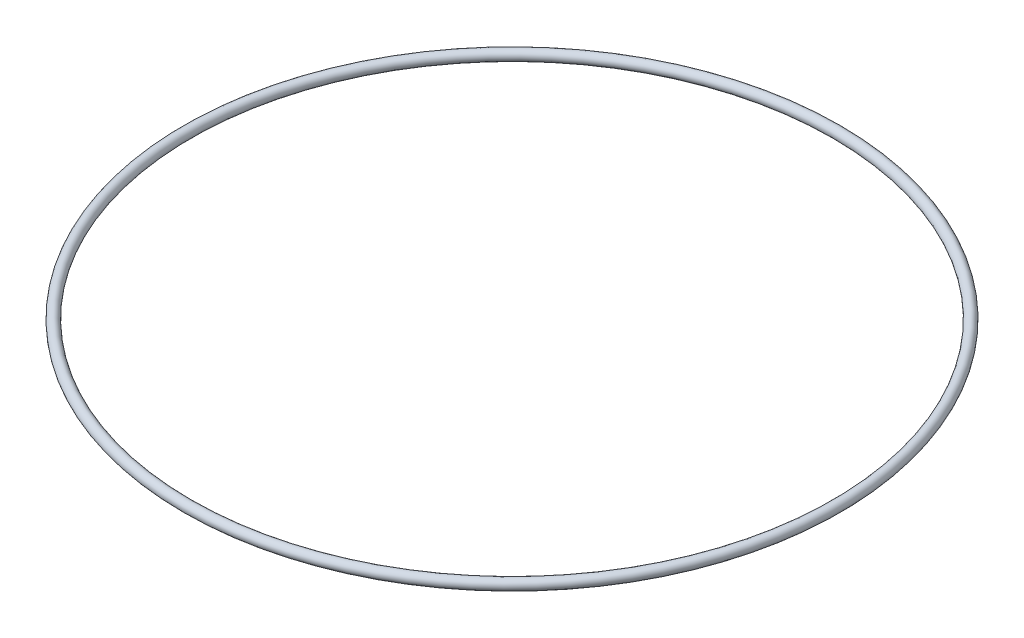
from build123d import *

# Parameters (mm, degrees)
WYCI_GNI_CIE_PO_CIE_CE1_PROFILE_R = 1


with BuildPart() as part:
    # Wyciągnięcie po ścieżce1: sweep along a path in Szkic1
    with BuildLine(Plane(origin=(0, 0, 0), x_dir=(1, 0, 0), z_dir=(0, 1, 0))) as wyci_gni_cie_po_cie_ce1_path:
        CenterArc((0, 0), 62.5, 0, 360)
    # Wyciągnięcie po ścieżce1 profile (on start of the path) → Wyciągnięcie po ścieżce1 (sweep)
    with BuildSketch(Plane(origin=(62.5, 0, 0), x_dir=(-1, 0, 0), z_dir=(0, 0, -1))):
        Circle(WYCI_GNI_CIE_PO_CIE_CE1_PROFILE_R)
    sweep(path=wyci_gni_cie_po_cie_ce1_path.line)


solid = part.part
